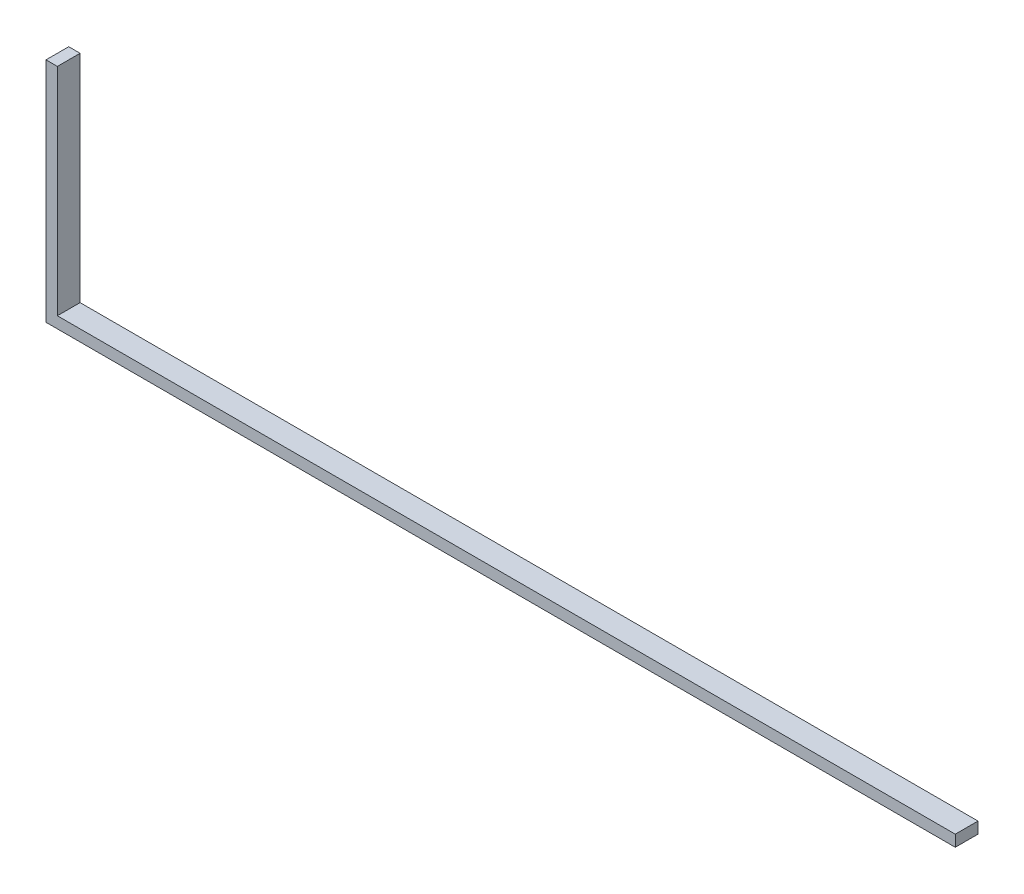
from build123d import *

# Parameters (mm, degrees)
EXTRUDE_1_DEPTH = 100


with BuildPart() as part:
    # 草图1 → 凸台-拉伸1 (new body)
    with BuildSketch(Plane.XY):
        Polygon((0, 1000), (0, 0), (4000, 0), (4000, 50), (50, 50), (50, 1000), align=None)
    extrude(amount=EXTRUDE_1_DEPTH)


solid = part.part
